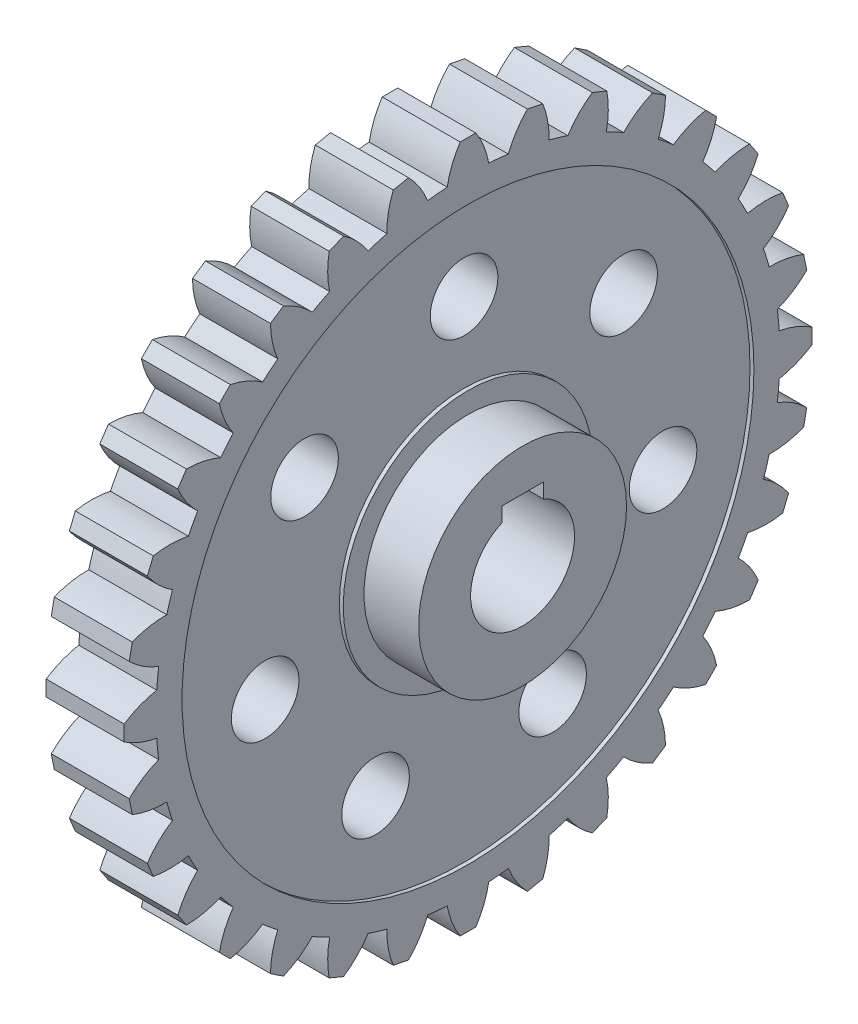
from build123d import *

# Parameters (mm, degrees)
SKETCH1_R           = 240
BOSS_EXTRUDE1_DEPTH = 30
BOSS_EXTRUDE2_DEPTH = 60
CIRPATTERN1_COUNT   = 32
SKETCH3_R           = 80
BOSS_EXTRUDE3_DEPTH = 72
CUT_EXTRUDE1_DEPTH  = 401.88059222
SKETCH5_R           = 220
SKETCH5_R_2         = 96
CUT_EXTRUDE2_DEPTH  = 3
SKETCH6_R           = 26
CUT_EXTRUDE3_DEPTH  = 388.001613974
CIRPATTERN2_COUNT   = 7


with BuildPart() as part:
    # Sketch1 → Boss-Extrude1 (new, symmetric)
    with BuildSketch(Plane(origin=(0, 0, 0), x_dir=(0, 0, -1), z_dir=(1, 0, 0))):
        Circle(SKETCH1_R)
    extrude(amount=BOSS_EXTRUDE1_DEPTH, both=True)

    # Sketch2 → Boss-Extrude2 (add)
    with BuildSketch(Plane(origin=(30, 0, 0), x_dir=(0, 0, -1), z_dir=(1, 0, 0))):
        with BuildLine():
            Line((-6, 264.546072754), (6, 264.546072754))
            ThreePointArc((6, 264.546072754), (12.257298292, 252.507387862), (16, 239.466072754))
            ThreePointArc((16, 239.466072754), (0, 240), (-16, 239.466072754))
            ThreePointArc((-16, 239.466072754), (-12.257298292, 252.507387862), (-6, 264.546072754))
        make_face()
    boss_extrude2 = extrude(amount=-BOSS_EXTRUDE2_DEPTH)

    # CirPattern1: Boss-Extrude2 ×32 about axis
    cirpattern1_axis = Axis((0, 0, 0), (1, 0, 0))
    for i in range(1, CIRPATTERN1_COUNT):
        add(boss_extrude2.rotate(cirpattern1_axis, i * 360 / CIRPATTERN1_COUNT))

    # Sketch3 → Boss-Extrude3 (add, symmetric)
    with BuildSketch(Plane(origin=(0, 0, 0), x_dir=(0, 0, -1), z_dir=(1, 0, 0))):
        Circle(SKETCH3_R)
    extrude(amount=BOSS_EXTRUDE3_DEPTH, both=True)

    # Sketch4 → Cut-Extrude1 (cut, through all)
    with BuildSketch(Plane(origin=(72, 0, 0), x_dir=(0, 0, -1), z_dir=(1, 0, 0))):
        with BuildLine():
            Line((-16, 48), (16, 48))
            Line((16, 48), (16, 36.66060556))
            ThreePointArc((16, 36.66060556), (0, -40), (-16, 36.66060556))
            Line((-16, 36.66060556), (-16, 48))
        make_face()
    extrude(amount=-CUT_EXTRUDE1_DEPTH, mode=Mode.SUBTRACT)

    # Sketch5 → Cut-Extrude2 (cut)
    with BuildSketch(Plane(origin=(30, 0, 0), x_dir=(0, 0, -1), z_dir=(1, 0, 0))):
        Circle(SKETCH5_R)
        Circle(SKETCH5_R_2, mode=Mode.SUBTRACT)
    extrude(amount=-CUT_EXTRUDE2_DEPTH, mode=Mode.SUBTRACT)

    # Sketch6 → Cut-Extrude3 (cut, through all)
    with BuildSketch(Plane(origin=(27, 0, 0), x_dir=(0, 0, -1), z_dir=(1, 0, 0))):
        with Locations((0, 157)):
            Circle(SKETCH6_R)
    cut_extrude3 = extrude(amount=-CUT_EXTRUDE3_DEPTH, mode=Mode.SUBTRACT)

    # CirPattern2: Cut-Extrude3 ×7 about axis
    cirpattern2_axis = Axis((0, 0, 0), (1, 0, 0))
    for i in range(1, CIRPATTERN2_COUNT):
        add(cut_extrude3.rotate(cirpattern2_axis, i * 360 / CIRPATTERN2_COUNT), mode=Mode.SUBTRACT)


solid = part.part
